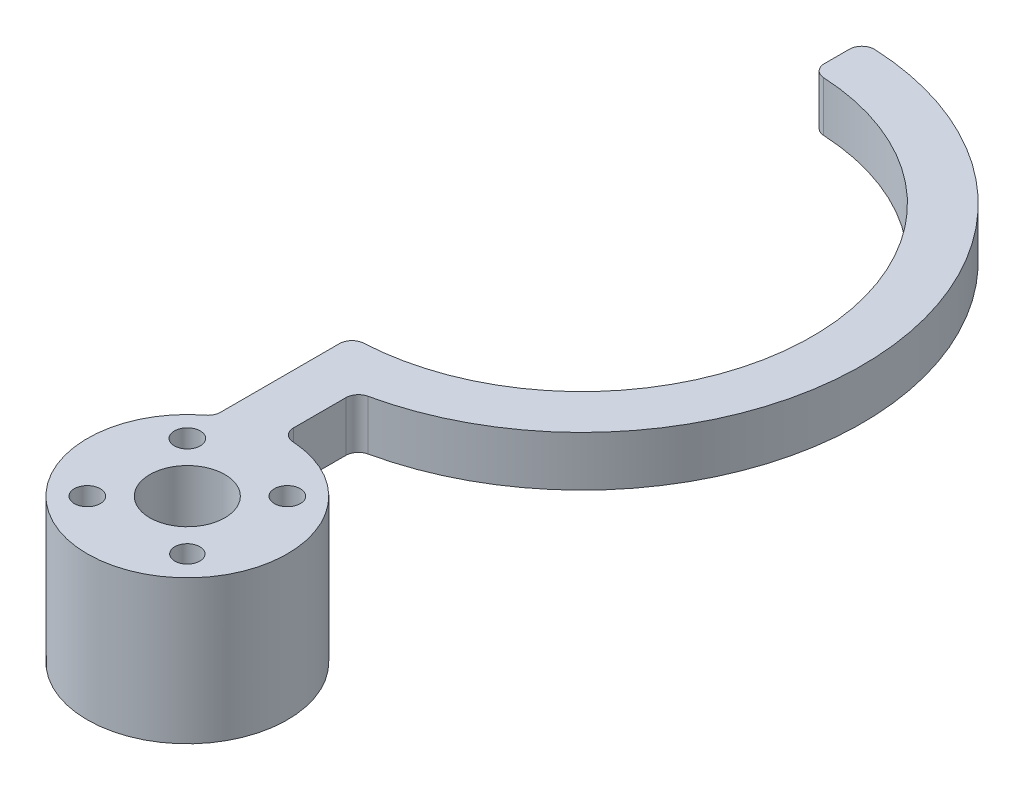
from build123d import *

# Parameters (mm, degrees)
SKETCH1_R           = 2.075
SKETCH1_R_2         = 6.003208263
BOSS_EXTRUDE2_DEPTH = 8
FILLET1_R           = 2
BOSS_EXTRUDE3_START = -23
SKETCH2_R           = 16
SKETCH2_R_2         = 6.003208263
SKETCH2_R_3         = 2.001534735
SKETCH2_R_4         = 2.075
BOSS_EXTRUDE3_DEPTH = 23


with BuildPart() as part:
    # Sketch1 → Boss-Extrude2 (new body)
    with BuildSketch(Plane(origin=(0, 0, 0), x_dir=(1, 0, 0), z_dir=(0, 1, 0))):
        with BuildLine():
            Line((0, 44.83), (0, 36.83))
            ThreePointArc((0, 36.83), (36.83, 0), (0, -36.83))
            Line((0, -36.83), (0, -46.83))
            Line((0, -46.83), (0, -58.83))
            ThreePointArc((0, -58.83), (14.116701064, -87.229775601), (8, -56.110417137))
            Line((8, -56.110417137), (8, -44.110417137))
            ThreePointArc((8, -44.110417137), (44.649741882, 4.016148637), (0, 44.83))
        make_face()
        with Locations(Location((0.96696537, -64.081170969, 0), (0, 0, 270))):
            Circle(SKETCH1_R, mode=Mode.SUBTRACT)
        with Locations(Location((16.96696537, -64.081170969, 0), (0, 0, 270))):
            Circle(SKETCH1_R, mode=Mode.SUBTRACT)
        with Locations(Location((16.96696537, -80.081170969, 0), (0, 0, 270))):
            Circle(SKETCH1_R, mode=Mode.SUBTRACT)
        with Locations(Location((0.96696537, -80.081170969, 0), (0, 0, 270))):
            Circle(SKETCH1_R, mode=Mode.SUBTRACT)
        with Locations(Location((8.96696537, -72.081170969, 0), (0, 0, 270))):
            Circle(SKETCH1_R_2, mode=Mode.SUBTRACT)
    extrude(amount=BOSS_EXTRUDE2_DEPTH)

    # Fillet1
    fillet1_edges = [part.edges().sort_by_distance(p)[0] for p in [
        (0, 4, 58.83),
        (0, 4, 36.83),
        (0, 4, -36.83),
        (0, 4, -44.83),
        (8, 4, 44.110417137),
        (8, 4, 56.110417137),
    ]]
    fillet(fillet1_edges, radius=FILLET1_R)

    # Sketch2 → Boss-Extrude3 (add)
    with BuildSketch(Plane(origin=(0, 8, 0), x_dir=(1, 0, 0), z_dir=(0, 1, 0)).offset(BOSS_EXTRUDE3_START)):
        with Locations(Location((8.96696537, -72.081170969, 0), (0, 0, 86.709940875))):
            Circle(SKETCH2_R)
        with Locations(Location((8.96696537, -72.081170969, 0), (0, 0, 270))):
            Circle(SKETCH2_R_2, mode=Mode.SUBTRACT)
        with Locations(Location((16.96696537, -80.081170969, 0), (0, 0, 270))):
            Circle(SKETCH2_R_3, mode=Mode.SUBTRACT)
        with Locations(Location((16.96696537, -64.081170969, 0), (0, 0, 270))):
            Circle(SKETCH2_R_4, mode=Mode.SUBTRACT)
        with Locations(Location((0.96696537, -64.081170969, 0), (0, 0, 270))):
            Circle(SKETCH2_R_4, mode=Mode.SUBTRACT)
        with Locations(Location((0.96696537, -80.081170969, 0), (0, 0, 270))):
            Circle(SKETCH2_R_4, mode=Mode.SUBTRACT)
    extrude(amount=BOSS_EXTRUDE3_DEPTH)


solid = part.part
